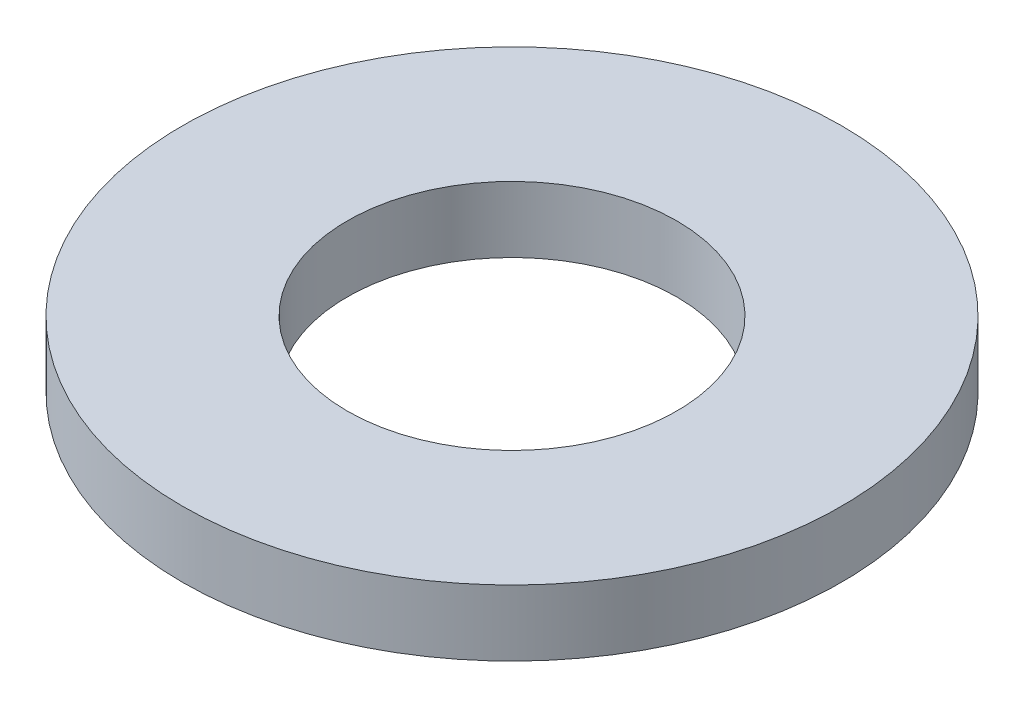
from build123d import *

# Parameters (mm, degrees)
ESQUISSE1_R        = 2.5
ESQUISSE1_R_2      = 1.25
BOSS_EXTRU_1_DEPTH = 0.5


with BuildPart() as part:
    # Esquisse1 → Boss.-Extru.1 (new body)
    with BuildSketch(Plane(origin=(0, 0, 0), x_dir=(1, 0, 0), z_dir=(0, 1, 0))):
        with Locations(Location((0, 0, 0), (0, 0, 270))):
            Circle(ESQUISSE1_R)
        with Locations(Location((0, 0, 0), (0, 0, 270))):
            Circle(ESQUISSE1_R_2, mode=Mode.SUBTRACT)
    extrude(amount=BOSS_EXTRU_1_DEPTH)


solid = part.part
